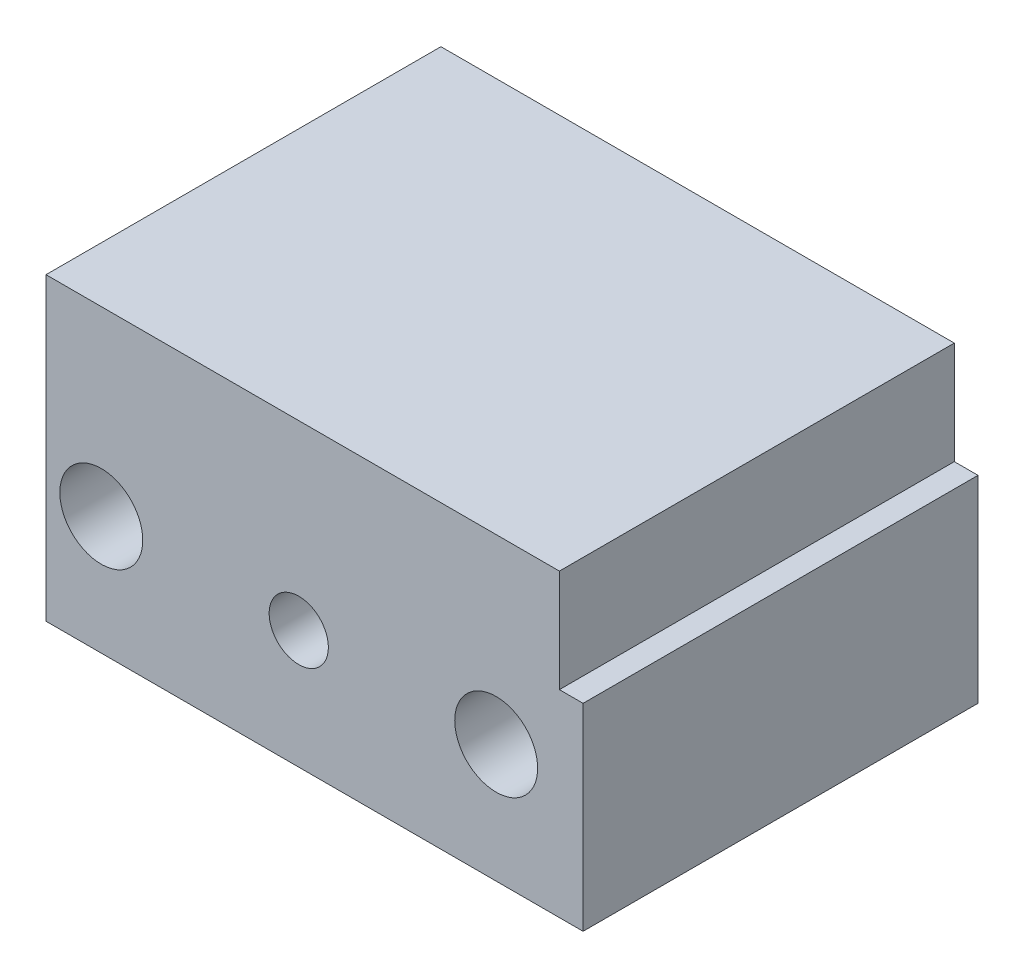
from build123d import *

# Parameters (mm, degrees)
SKETCH1_W                = 6.8
SKETCH1_H                = 5
BOSS_EXTRUDE1_DEPTH      = 3.8
HOLE1_D                  = 1.05
HOLE1_CBORE_D            = 1.3
HOLE1_CBORE_DEPTH        = 1.2
SKETCH20_W               = 5
SKETCH20_H               = 1.3
CUT_EXTRUDE11_DEPTH      = 0.3
M1_0X0_25_TAPPED_HOLE1_D = 0.75


with BuildPart() as part:
    # Sketch1 → Boss-Extrude1 (new body)
    with BuildSketch(Plane(origin=(0, 4, 0), x_dir=(-1, 0, 0), z_dir=(0, 1, 0))):
        with Locations((-3.4, 2.5)):
            Rectangle(SKETCH1_W, SKETCH1_H)
    extrude(amount=-BOSS_EXTRUDE1_DEPTH)

    # Hole1 (through all)
    with Locations(Plane(origin=(0, 0, 0), x_dir=(-1, 0, 0), z_dir=(0, 0, -1))):
        with Locations((-5.7, 1.7), (-0.7, 1.7)):
            CounterBoreHole(HOLE1_D / 2, HOLE1_CBORE_D / 2, HOLE1_CBORE_DEPTH)

    # Sketch20 → Cut-Extrude11 (cut)
    with BuildSketch(Plane(origin=(6.8, 0, 0), x_dir=(0, 0, -1), z_dir=(1, 0, 0))):
        with Locations((-2.5, 3.35)):
            Rectangle(SKETCH20_W, SKETCH20_H)
    extrude(amount=-CUT_EXTRUDE11_DEPTH, mode=Mode.SUBTRACT)

    # M1.0x0.25 Tapped Hole1 (through all)
    with Locations(Plane(origin=(0, 0, 0), x_dir=(-1, 0, 0), z_dir=(0, 0, -1))):
        with Locations((-3.2, 1.7)):
            Hole(M1_0X0_25_TAPPED_HOLE1_D / 2)


solid = part.part
